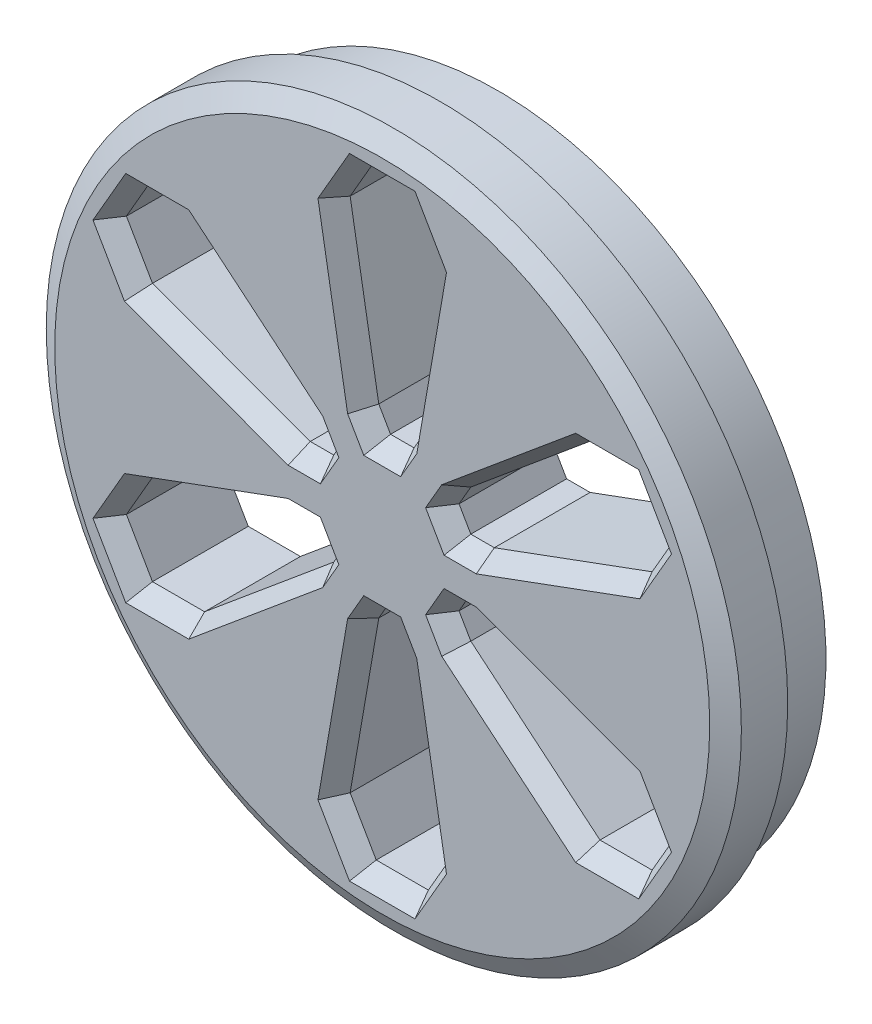
from build123d import *
from OCP.BRepFilletAPI import BRepFilletAPI_MakeChamfer

# Parameters (mm, degrees)
SKETCH_1_R          = 30
EXTRUDE_1_DEPTH     = 10
SKETCH_3_R          = 4.064215012
CUT_EXTRUDE_1_DEPTH = 7
SKETCH_4_OUTSIDE_W  = 79.088
SKETCH_4_OUTSIDE_H  = 79.088
SKETCH_4_OUTSIDE_R  = 28.3
CUT_EXTRUDE_2_DEPTH = 5
CHAMFER_2_SIZE      = 1
CHAMFER_2_SIZE2     = 1.732050808


with BuildPart() as part:
    # 스케치1 → 보스-돌출1 (new body)
    with BuildSketch(Plane.XY):
        Circle(SKETCH_1_R)
        Polygon((4.5, 22.3), (2.029624384, 8), (1.014812192, 6.242293723), (-1.014812192, 6.242293723), (-2.029624384, 8), (-4.5, 22.3), (-2.25, 26.197114317), (2.25, 26.197114317), align=None, mode=Mode.SUBTRACT)
        Polygon((23.812366504, 11.15), (21.562366504, 15.047114317), (17.062366504, 15.047114317), (5.913391038, 5.757706277), (4.898578846, 4), (5.913391038, 2.242293723), (7.943015422, 2.242293723), (21.562366504, 7.252885683), align=None, mode=Mode.SUBTRACT)
        Polygon((21.562366504, -15.047114317), (23.812366504, -11.15), (21.562366504, -7.252885683), (7.943015422, -2.242293723), (5.913391038, -2.242293723), (4.898578846, -4), (5.913391038, -5.757706277), (17.062366504, -15.047114317), align=None, mode=Mode.SUBTRACT)
        Polygon((-2.25, -26.197114317), (2.25, -26.197114317), (4.5, -22.3), (2.029624384, -8), (1.014812192, -6.242293723), (-1.014812192, -6.242293723), (-2.029624384, -8), (-4.5, -22.3), align=None, mode=Mode.SUBTRACT)
        Polygon((-23.812366504, -11.15), (-21.562366504, -15.047114317), (-17.062366504, -15.047114317), (-5.913391038, -5.757706277), (-4.898578846, -4), (-5.913391038, -2.242293723), (-7.943015422, -2.242293723), (-21.562366504, -7.252885683), align=None, mode=Mode.SUBTRACT)
        Polygon((-21.562366504, 15.047114317), (-23.812366504, 11.15), (-21.562366504, 7.252885683), (-7.943015422, 2.242293723), (-5.913391038, 2.242293723), (-4.898578846, 4), (-5.913391038, 5.757706277), (-17.062366504, 15.047114317), align=None, mode=Mode.SUBTRACT)
    extrude(amount=EXTRUDE_1_DEPTH)

    # 스케치3 → 컷-돌출1 (cut)
    with BuildSketch(Plane(origin=(0, 0, 0), x_dir=(-1, 0, 0), z_dir=(0, 0, -1))):
        Circle(SKETCH_3_R)
    extrude(amount=-CUT_EXTRUDE_1_DEPTH, mode=Mode.SUBTRACT)

    # 스케치4 outside → 컷-돌출2 (cut)
    with BuildSketch(Plane(origin=(0, 0, 0), x_dir=(-1, 0, 0), z_dir=(0, 0, -1))):
        Rectangle(SKETCH_4_OUTSIDE_W, SKETCH_4_OUTSIDE_H)
        Circle(SKETCH_4_OUTSIDE_R, mode=Mode.SUBTRACT)
    extrude(amount=-CUT_EXTRUDE_2_DEPTH, mode=Mode.SUBTRACT)

    # 모따기2: one chamfer whose edges measure the first distance from different faces: ONE call of the kernel's chamfer builder (chamfer() names one face for all edges)
    chamfer_2_edges_1 = [part.edges().sort_by_distance(p)[0] for p in [
        (5.405984942, -3.121146861, 10),
        (1.522218288, -7.121146861, 10),
        (1.522218288, 7.121146861, 10),
        (3.264812192, -15.15, 10),
        (3.375, -24.248557159, 10),
        (0, -26.197114317, 10),
        (-3.375, -24.248557159, 10),
        (-3.264812192, -15.15, 10),
        (-1.522218288, -7.121146861, 10),
        (0, -6.242293723, 10),
        (-5.405984942, -4.878853139, 10),
        (-11.487878771, -10.402410297, 10),
        (-19.312366504, -15.047114317, 10),
        (0, 6.242293723, 10),
        (-22.687366504, -13.098557159, 10),
        (-22.687366504, -9.201442841, 10),
        (-14.752690963, -4.747589703, 10),
        (-6.92820323, -2.242293723, 10),
        (-5.405984942, -3.121146861, 10),
        (-6.92820323, 2.242293723, 10),
        (-14.752690963, 4.747589703, 10),
        (-22.687366504, 9.201442841, 10),
        (-22.687366504, 13.098557159, 10),
        (-19.312366504, 15.047114317, 10),
        (-1.522218288, 7.121146861, 10),
        (-11.487878771, 10.402410297, 10),
        (-5.405984942, 4.878853139, 10),
        (-5.405984942, 3.121146861, 10),
        (-3.264812192, 15.15, 10),
        (-3.375, 24.248557159, 10),
        (0, 26.197114317, 10),
        (3.375, 24.248557159, 10),
        (3.264812192, 15.15, 10),
        (5.405984942, 4.878853139, 10),
        (11.487878771, 10.402410297, 10),
        (19.312366504, 15.047114317, 10),
        (22.687366504, 13.098557159, 10),
        (22.687366504, 9.201442841, 10),
        (14.752690963, 4.747589703, 10),
        (6.92820323, 2.242293723, 10),
        (5.405984942, 3.121146861, 10),
        (6.92820323, -2.242293723, 10),
        (14.752690963, -4.747589703, 10),
        (22.687366504, -9.201442841, 10),
        (22.687366504, -13.098557159, 10),
        (19.312366504, -15.047114317, 10),
        (11.487878771, -10.402410297, 10),
        (5.405984942, -4.878853139, 10),
    ]]
    chamfer_2_side_1 = [part.faces().sort_by_distance(p)[0] for p in [
        (0, 0, 10),
    ]]
    chamfer_2_edges_2 = [part.edges().sort_by_distance(p)[0] for p in [
        (-30, 0, 10),
    ]]
    chamfer_2_side_2 = [part.faces().sort_by_distance(p)[0] for p in [
        (-30, 0, 7.5),
    ]]
    chamfer_2 = BRepFilletAPI_MakeChamfer(part.part.solid().wrapped)
    for e in chamfer_2_edges_1:
        chamfer_2.Add(CHAMFER_2_SIZE, CHAMFER_2_SIZE2, e.wrapped, chamfer_2_side_1[0].wrapped)  # the first distance lies on this face
    for e in chamfer_2_edges_2:
        chamfer_2.Add(CHAMFER_2_SIZE, CHAMFER_2_SIZE2, e.wrapped, chamfer_2_side_2[0].wrapped)  # the first distance lies on this face
    add(Compound.cast(chamfer_2.Shape()), mode=Mode.REPLACE)


solid = part.part
